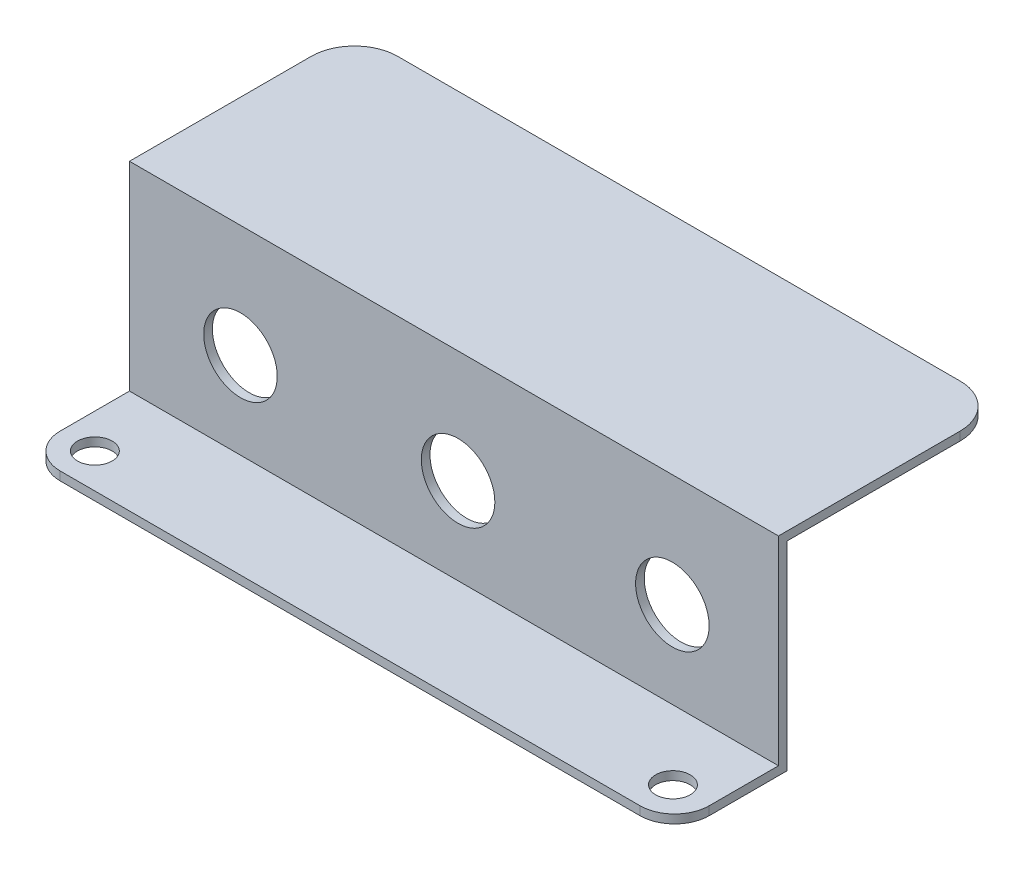
from build123d import *

# Parameters (mm, degrees)
SKETCH1_W           = 75
SKETCH1_H           = 25
BOSS_EXTRUDE1_DEPTH = 1
SKETCH3_W           = 75
SKETCH3_H           = 24
BOSS_EXTRUDE2_DEPTH = 1
SKETCH4_W           = 75
SKETCH4_H           = 12
SKETCH4_R           = 2
BOSS_EXTRUDE3_DEPTH = 1
FILLET1_R           = 4
CUT_EXTRUDE2_REACH  = 62.869
SKETCH6_R           = 4.25
FILLET2_R           = 5


with BuildPart() as part:
    # Sketch1 → Boss-Extrude1 (new body)
    with BuildSketch(Plane(origin=(0, 0, 0), x_dir=(1, 0, 0), z_dir=(0, 1, 0))):
        with Locations((-12.5, -2.5)):
            Rectangle(SKETCH1_W, SKETCH1_H)
    extrude(amount=BOSS_EXTRUDE1_DEPTH)

    # Sketch3 → Boss-Extrude2 (add)
    with BuildSketch(Plane.XY.offset(15)):
        with Locations((-12.5, -11)):
            Rectangle(SKETCH3_W, SKETCH3_H)
    extrude(amount=BOSS_EXTRUDE2_DEPTH)

    # Sketch4 → Boss-Extrude3 (add)
    with BuildSketch(Plane.XZ.offset(23)):
        with Locations((-12.5, 22)):
            Rectangle(SKETCH4_W, SKETCH4_H)
        with Locations(Location((20.805858618, 24, 0), (0, 0, 270))):
            Circle(SKETCH4_R, mode=Mode.SUBTRACT)
        with Locations(Location((-46, 24, 0), (0, 0, 270))):
            Circle(SKETCH4_R, mode=Mode.SUBTRACT)
    extrude(amount=-BOSS_EXTRUDE3_DEPTH)

    # Fillet1
    fillet1_edges = [part.edges().sort_by_distance(p)[0] for p in [
        (-50, -22.5, 28),
        (25, -22.5, 28),
    ]]
    fillet(fillet1_edges, radius=FILLET1_R)

    # Sketch6 → Cut-Extrude2 (cut, up to next)
    with BuildSketch(Plane.XY.offset(16), mode=Mode.PRIVATE) as cut_extrude2_sk1:
        with Locations((-37.172974346, -12)):
            Circle(SKETCH6_R)
    cut_extrude2_tool1 = extrude(cut_extrude2_sk1.sketch, amount=-CUT_EXTRUDE2_REACH, mode=Mode.PRIVATE) & part.part
    # Sketch6 → Cut-Extrude2 (cut, up to next)
    with BuildSketch(Plane.XY.offset(16), mode=Mode.PRIVATE) as cut_extrude2_sk2:
        with Locations((-12.026924054, -12)):
            Circle(SKETCH6_R)
    cut_extrude2_tool2 = extrude(cut_extrude2_sk2.sketch, amount=-CUT_EXTRUDE2_REACH, mode=Mode.PRIVATE) & part.part
    # Sketch6 → Cut-Extrude2 (cut, up to next)
    with BuildSketch(Plane.XY.offset(16), mode=Mode.PRIVATE) as cut_extrude2_sk3:
        with Locations((12.738125476, -12)):
            Circle(SKETCH6_R)
    cut_extrude2_tool3 = extrude(cut_extrude2_sk3.sketch, amount=-CUT_EXTRUDE2_REACH, mode=Mode.PRIVATE) & part.part
    add(cut_extrude2_tool1.solids().sort_by_distance((-37.172974, -12, 16))[0], mode=Mode.SUBTRACT)
    add(cut_extrude2_tool2.solids().sort_by_distance((-12.026924, -12, 16))[0], mode=Mode.SUBTRACT)
    add(cut_extrude2_tool3.solids().sort_by_distance((12.738125, -12, 16))[0], mode=Mode.SUBTRACT)

    # Fillet2
    fillet2_edges = [part.edges().sort_by_distance(p)[0] for p in [
        (-50, 0.5, -10),
        (25, 0.5, -10),
    ]]
    fillet(fillet2_edges, radius=FILLET2_R)


solid = part.part
